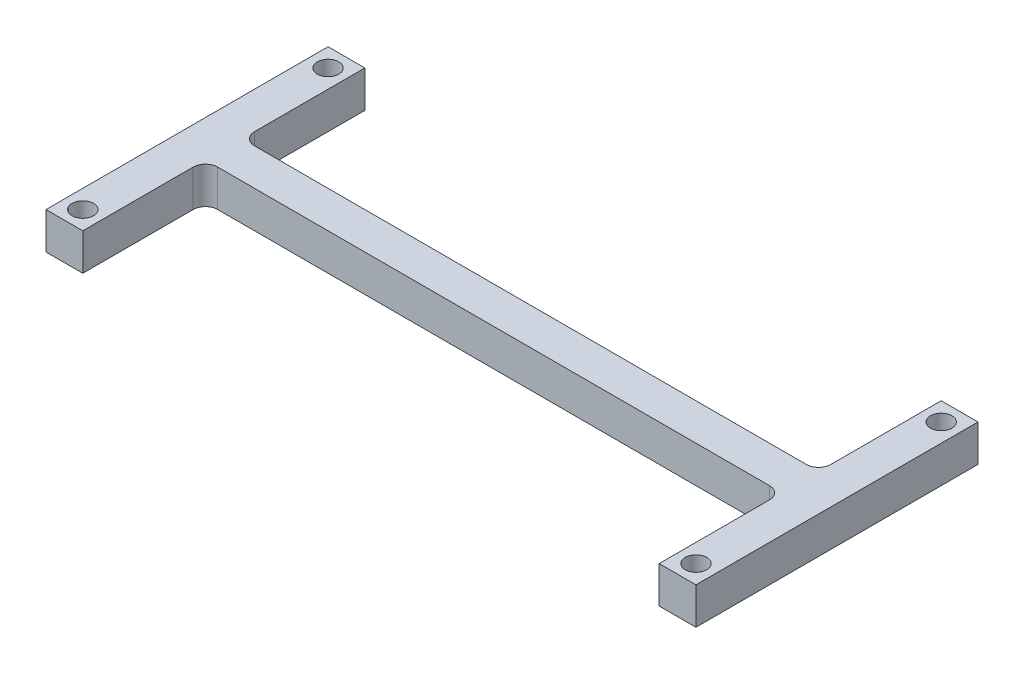
from build123d import *

# Parameters (mm, degrees)
SKETCH1_W           = 106
SKETCH1_H           = 6
BOSS_EXTRUDE1_DEPTH = 6
SKETCH2_W           = 6
SKETCH2_H           = 20
SKETCH2_R           = 1.75
BOSS_EXTRUDE2_DEPTH = 6
FILLET1_R           = 2


with BuildPart() as part:
    # Sketch1 → Boss-Extrude1 (new body)
    with BuildSketch(Plane(origin=(0, 0, 0), x_dir=(1, 0, 0), z_dir=(0, 1, 0))):
        Rectangle(SKETCH1_W, SKETCH1_H)
    extrude(amount=BOSS_EXTRUDE1_DEPTH)

    # Sketch2 → Boss-Extrude2 (add)
    # profile 1 of 4: a face of its own
    with BuildSketch(Plane(origin=(0, 6, 0), x_dir=(1, 0, 0), z_dir=(0, 1, 0))):
        with Locations((-50, 13)):
            Rectangle(SKETCH2_W, SKETCH2_H)
        with Locations(Location((-50, 20, 0), (0, 0, 270))):
            Circle(SKETCH2_R, mode=Mode.SUBTRACT)
    # profile 2 of 4: a face of its own
    with BuildSketch(Plane(origin=(0, 6, 0), x_dir=(1, 0, 0), z_dir=(0, 1, 0))):
        with Locations((-50, -13)):
            Rectangle(SKETCH2_W, SKETCH2_H)
        with Locations(Location((-50, -20, 0), (0, 0, 90))):
            Circle(SKETCH2_R, mode=Mode.SUBTRACT)
    # profile 3 of 4: a face of its own
    with BuildSketch(Plane(origin=(0, 6, 0), x_dir=(1, 0, 0), z_dir=(0, 1, 0))):
        with Locations((50, -13)):
            Rectangle(SKETCH2_W, SKETCH2_H)
        with Locations(Location((50, -20, 0), (0, 0, 270))):
            Circle(SKETCH2_R, mode=Mode.SUBTRACT)
    # profile 4 of 4: a face of its own
    with BuildSketch(Plane(origin=(0, 6, 0), x_dir=(1, 0, 0), z_dir=(0, 1, 0))):
        with Locations((50, 13)):
            Rectangle(SKETCH2_W, SKETCH2_H)
        with Locations(Location((50, 20, 0), (0, 0, 90))):
            Circle(SKETCH2_R, mode=Mode.SUBTRACT)
    extrude(amount=-BOSS_EXTRUDE2_DEPTH)

    # Fillet1
    fillet1_edges = [part.edges().sort_by_distance(p)[0] for p in [
        (-47, 3, -3),
        (-47, 3, 3),
        (47, 3, 3),
        (47, 3, -3),
    ]]
    fillet(fillet1_edges, radius=FILLET1_R)


solid = part.part
